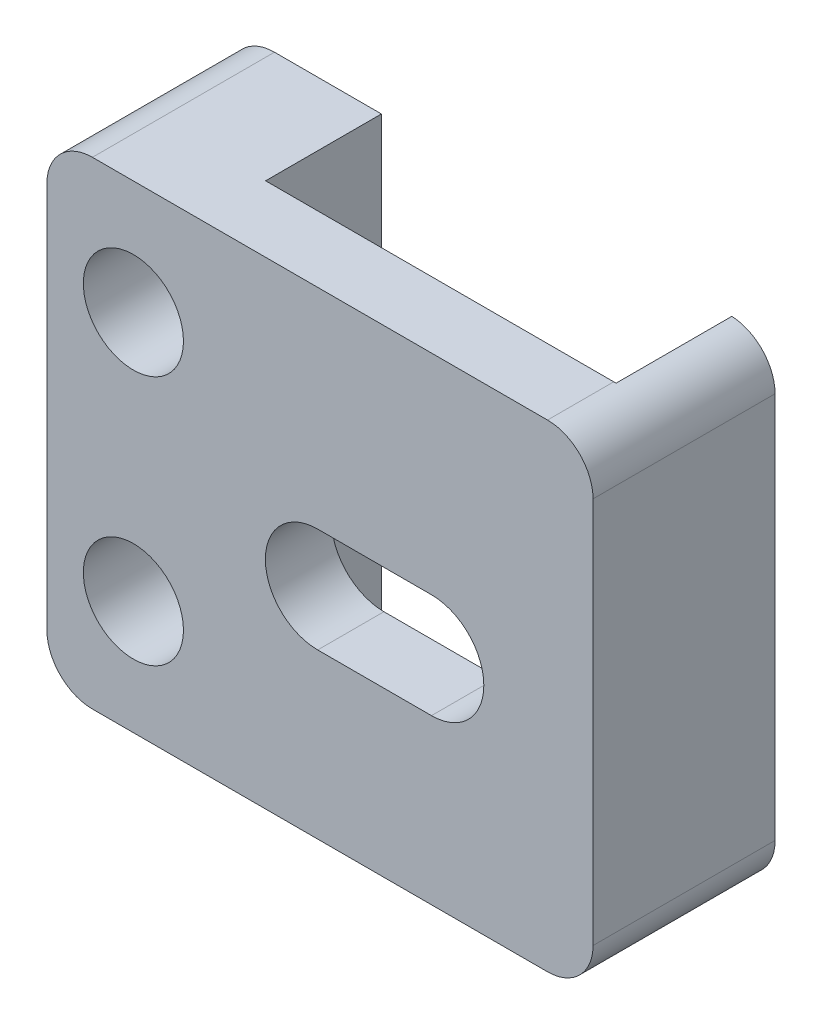
from build123d import *

# Parameters (mm, degrees)
SKETCH1_W              = 9.5
SKETCH1_H              = 4
BOSS_EXTRUDE1_DEPTH    = 10.5
BREAKBEAM_HOLE_1_DEPTH = 9.5
SKETCH5_W              = 4
SKETCH5_H              = 10.5
BOSS_EXTRUDE4_DEPTH    = 2.5
FILLET1_R              = 1
M2_CLEARANCE_HOLE_D    = 2.2
SKETCH15_W             = 7.7
SKETCH15_H             = 10.1
SKETCH15_W_2           = 7.1
SKETCH15_H_2           = 9.5
CUT_EXTRUDE5_DEPTH     = 2.544836551
CUT_EXTRUDE6_DEPTH     = 1.46


with BuildPart() as part:
    # Sketch1 → Boss-Extrude1 (new body)
    with BuildSketch(Plane(origin=(0, 0, 0), x_dir=(1, 0, 0), z_dir=(0, 1, 0))):
        with Locations((4.75, -2)):
            Rectangle(SKETCH1_W, SKETCH1_H)
    extrude(amount=BOSS_EXTRUDE1_DEPTH)

    # Sketch2 → Breakbeam Hole 1 (cut)
    with BuildSketch(Plane(origin=(0, 10.5, 0), x_dir=(1, 0, 0), z_dir=(0, 1, 0))):
        Polygon((8.25, -2.544836551), (8.25, -1.5), (8.25, 0), (1.15, 0), (1.15, -1.5), (1.15, -2.544836551), align=None)
    extrude(amount=-BREAKBEAM_HOLE_1_DEPTH, mode=Mode.SUBTRACT)

    # Sketch5 → Boss-Extrude4 (add)
    with BuildSketch(Plane.ZY):
        with Locations((2, 5.25)):
            Rectangle(SKETCH5_W, SKETCH5_H)
    extrude(amount=BOSS_EXTRUDE4_DEPTH)

    # Fillet1
    fillet1_edges = [part.edges().sort_by_distance(p)[0] for p in [
        (9.5, 10.5, 2),
        (-2.5, 0, 2),
        (-2.5, 10.5, 2),
        (9.5, 0, 2),
    ]]
    fillet(fillet1_edges, radius=FILLET1_R)

    # M2 Clearance Hole (through all)
    with Locations(Plane.XY.offset(4)):
        with Locations((-0.6, 8), (-0.6, 2.5)):
            Hole(M2_CLEARANCE_HOLE_D / 2)

    # Sketch15 → Cut-Extrude5 (cut)
    with BuildSketch(Plane(origin=(0, 0, 0), x_dir=(-1, 0, 0), z_dir=(0, 0, -1))):
        with Locations((-4.7, 5.75)):
            Rectangle(SKETCH15_W, SKETCH15_H)
        with Locations((-4.7, 5.75)):
            Rectangle(SKETCH15_W_2, SKETCH15_H_2, mode=Mode.SUBTRACT)
    extrude(amount=-CUT_EXTRUDE5_DEPTH, mode=Mode.SUBTRACT)

    # Sketch16 → Cut-Extrude6 (cut)
    with BuildSketch(Plane.XY.offset(4)):
        with BuildLine():
            Line((3.45, 5.9), (5.95, 5.9))
            ThreePointArc((5.95, 5.9), (7.1, 4.75), (5.95, 3.6))
            Line((5.95, 3.6), (3.45, 3.6))
            ThreePointArc((3.45, 3.6), (2.3, 4.75), (3.45, 5.9))
        make_face()
    extrude(amount=-CUT_EXTRUDE6_DEPTH, mode=Mode.SUBTRACT)


solid = part.part
